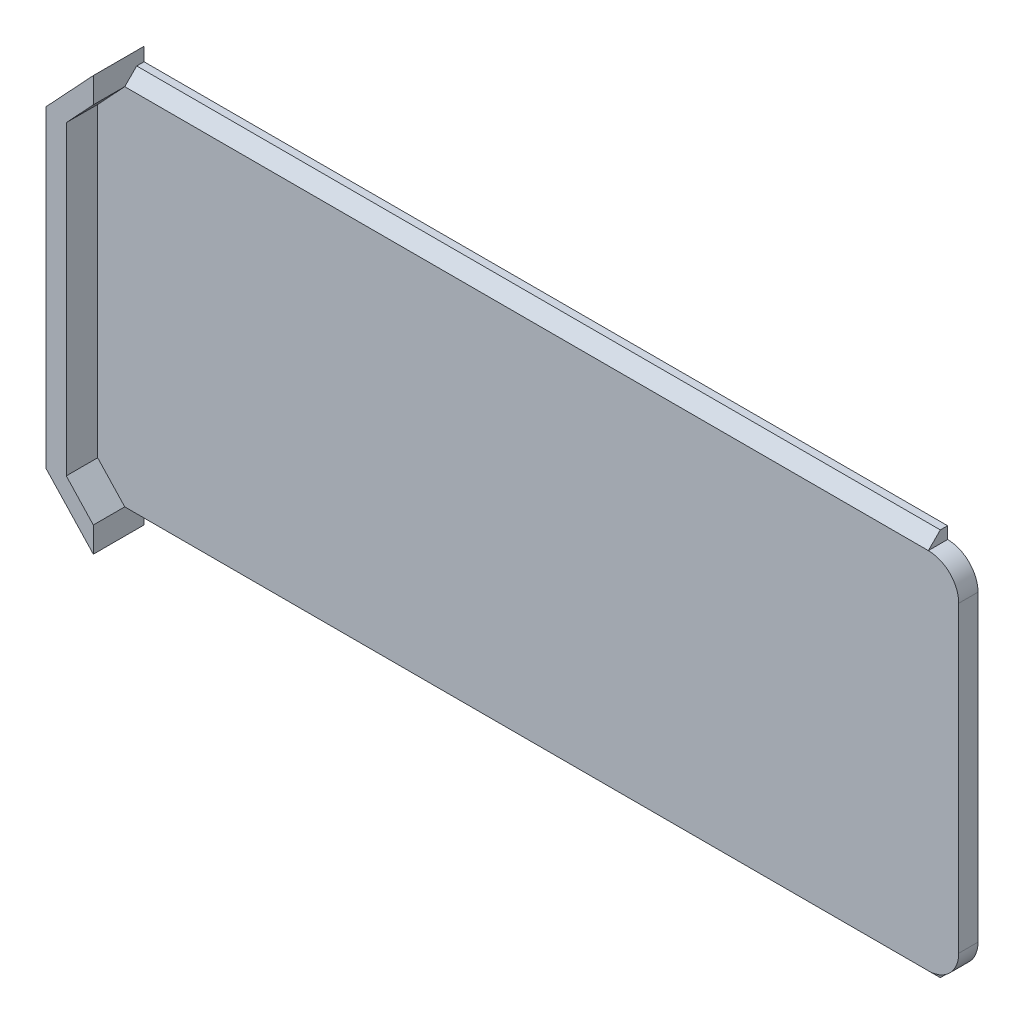
from build123d import *

# Parameters (mm, degrees)
BOSS_EXTRUDE1_DEPTH = 1.9
BOSS_EXTRUDE2_DEPTH = 5
SKETCH4_W           = 79.3
SKETCH4_H           = 1.9
BOSS_EXTRUDE3_DEPTH = 1.18
SKETCH5_W           = 79.3
SKETCH5_H           = 1.9
BOSS_EXTRUDE4_DEPTH = 1.18
CHAMFER2_SIZE       = 1.18


with BuildPart() as part:
    # Sketch3 → Boss-Extrude1 (new body)
    with BuildSketch(Plane.XY):
        with BuildLine():
            Line((-37.828427125, -38.75), (-37.828427125, -36.25))
            Line((-37.828427125, -36.25), (-42.5, -41.249558803))
            Line((-42.5, -41.249558803), (-42.5, -72.16))
            Line((-42.5, -72.16), (-37.828427125, -77.16))
            Line((-37.828427125, -77.16), (-37.828427125, -74.66))
            Line((-37.828427125, -74.66), (41.471572875, -74.66))
            ThreePointArc((41.471572875, -74.66), (43.592893219, -73.781320344), (44.471572875, -71.66))
            Line((44.471572875, -71.66), (44.471572875, -41.75))
            ThreePointArc((44.471572875, -41.75), (43.592893219, -39.628679656), (41.471572875, -38.75))
            Line((41.471572875, -38.75), (-37.828427125, -38.75))
        make_face()
    extrude(amount=BOSS_EXTRUDE1_DEPTH)

    # Sketch3<5> → Boss-Extrude2 (add)
    with BuildSketch(Plane.XY):
        Polygon((-37.828427125, -38.75), (-37.828427125, -36.25), (-42.5, -41.249558803), (-42.5, -72.16), (-37.828427125, -77.16), (-37.828427125, -74.66), (-40.5, -71.800606658), (-40.5, -41.609141031), align=None)
    extrude(amount=BOSS_EXTRUDE2_DEPTH)

    # Sketch4 → Boss-Extrude3 (add)
    with BuildSketch(Plane.XZ.offset(74.66)):
        with Locations((1.821572875, 0.95)):
            Rectangle(SKETCH4_W, SKETCH4_H)
    extrude(amount=BOSS_EXTRUDE3_DEPTH)

    # Sketch5 → Boss-Extrude4 (add)
    with BuildSketch(Plane(origin=(0, -38.75, 0), x_dir=(1, 0, 0), z_dir=(0, 1, 0))):
        with Locations((1.821572875, -0.95)):
            Rectangle(SKETCH5_W, SKETCH5_H)
    extrude(amount=BOSS_EXTRUDE4_DEPTH)

    # Chamfer2
    chamfer2_edges = [part.edges().sort_by_distance(p)[0] for p in [
        (1.821572875, -75.84, 1.9),
        (1.821572875, -37.57, 1.9),
    ]]
    chamfer(chamfer2_edges, length=CHAMFER2_SIZE)


solid = part.part
